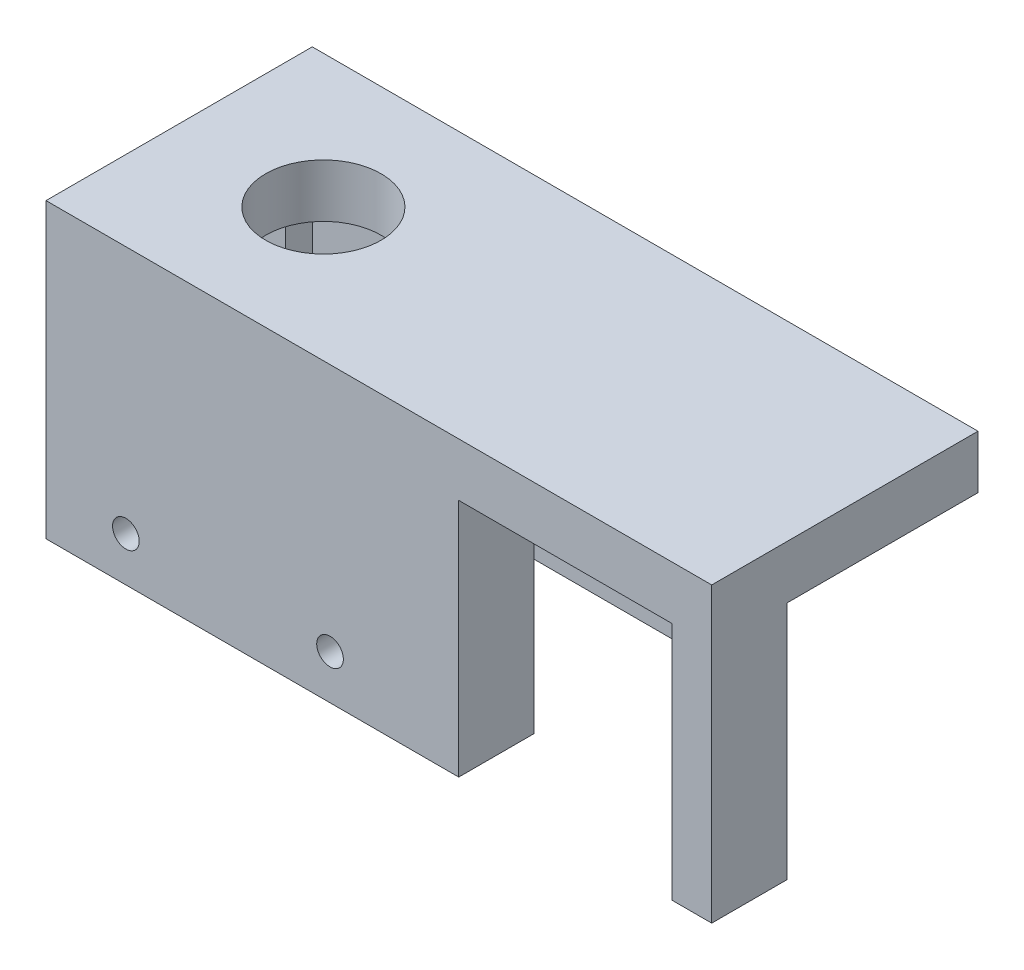
from build123d import *

# Parameters (mm, degrees)
SKETCH1_W           = 75
SKETCH1_H           = 30
BOSS_EXTRUDE1_DEPTH = 6
SKETCH2_W           = 4.5
SKETCH2_H           = 4.5
SKETCH2_W_2         = 38.5
SKETCH2_H_2         = 21
SKETCH2_W_3         = 5
SKETCH2_W_4         = 36
SKETCH2_W_5         = 6
SKETCH2_H_3         = 4
SKETCH2_H_4         = 8.5
BOSS_EXTRUDE4_DEPTH = 27
SKETCH7_W           = 4.5
SKETCH7_H           = 15
CUT_EXTRUDE1_DEPTH  = 6
SKETCH9_R           = 6.5
CUT_EXTRUDE2_DEPTH  = 30
SKETCH10_R          = 1.5
CUT_EXTRUDE3_DEPTH  = 50
SKETCH11_R          = 1.5
CUT_EXTRUDE4_DEPTH  = 10
SKETCH12_W          = 15
SKETCH12_H          = 26
CUT_EXTRUDE5_DEPTH  = 5


with BuildPart() as part:
    # Sketch1 → Boss-Extrude1 (new body)
    with BuildSketch(Plane.XZ.offset(4.342044015)):
        with Locations((-49.069594933, 13.200391181)):
            Rectangle(SKETCH1_W, SKETCH1_H)
    extrude(amount=BOSS_EXTRUDE1_DEPTH)

    # Sketch2 → Boss-Extrude4 (add)
    with BuildSketch(Plane(origin=(0, -10.342044015, 0), x_dir=(-1, 0, 0), z_dir=(0, -1, 0))):
        with Locations((84.319594933, -0.450391181)):
            Rectangle(SKETCH2_W, SKETCH2_H)
        with Locations((62.819594933, -0.450391181)):
            Rectangle(SKETCH2_W_2, SKETCH2_H)
        with Locations((84.319594933, -13.200391181)):
            Rectangle(SKETCH2_W, SKETCH2_H_2)
        with Locations((41.069594933, -0.450391181)):
            Rectangle(SKETCH2_W_3, SKETCH2_H)
        with Locations((84.319594933, -25.950391181)):
            Rectangle(SKETCH2_W, SKETCH2_H)
        with Locations((41.069594933, -4.950391181)):
            Rectangle(SKETCH2_W_3, SKETCH2_H)
        with Locations((64.069594933, -25.950391181)):
            Rectangle(SKETCH2_W_4, SKETCH2_H)
        with Locations((43.069594933, -25.950391181)):
            Rectangle(SKETCH2_W_5, SKETCH2_H)
        with Locations((43.069594933, -21.700391181)):
            Rectangle(SKETCH2_W_5, SKETCH2_H_3)
        with Locations((13.819594933, -23.950391181)):
            Rectangle(SKETCH2_W, SKETCH2_H_4)
    extrude(amount=BOSS_EXTRUDE4_DEPTH)

    # Sketch7 → Cut-Extrude1 (cut)
    with BuildSketch(Plane(origin=(-38.569594933, 0, 0), x_dir=(0, 0, -1), z_dir=(1, 0, 0))):
        with Locations((-4.950391181, -29.842044015)):
            Rectangle(SKETCH7_W, SKETCH7_H)
    extrude(amount=-CUT_EXTRUDE1_DEPTH, mode=Mode.SUBTRACT)

    # Sketch9 → Cut-Extrude2 (cut)
    with BuildSketch(Plane(origin=(0, -4.342044015, 0), x_dir=(1, 0, 0), z_dir=(0, 1, 0))):
        with Locations(Location((-70.319594933, -13.200391181, 0), (0, 0, 180))):
            Circle(SKETCH9_R)
    extrude(amount=-CUT_EXTRUDE2_DEPTH, mode=Mode.SUBTRACT)

    # Sketch10 → Cut-Extrude3 (cut)
    with BuildSketch(Plane.XY.offset(28.200391181)):
        with Locations((-77.569594933, -32.342044015)):
            Circle(SKETCH10_R)
    extrude(amount=-CUT_EXTRUDE3_DEPTH, mode=Mode.SUBTRACT)

    # Sketch11 → Cut-Extrude4 (cut)
    with BuildSketch(Plane.XY.offset(28.200391181)):
        with Locations((-54.569594933, -32.342044015)):
            Circle(SKETCH11_R)
    extrude(amount=-CUT_EXTRUDE4_DEPTH, mode=Mode.SUBTRACT)

    # Sketch12 → Cut-Extrude5 (cut)
    with BuildSketch(Plane.ZY.offset(86.569594933)):
        with Locations((13.200391181, -24.342044015)):
            Rectangle(SKETCH12_W, SKETCH12_H)
    extrude(amount=-CUT_EXTRUDE5_DEPTH, mode=Mode.SUBTRACT)


solid = part.part
